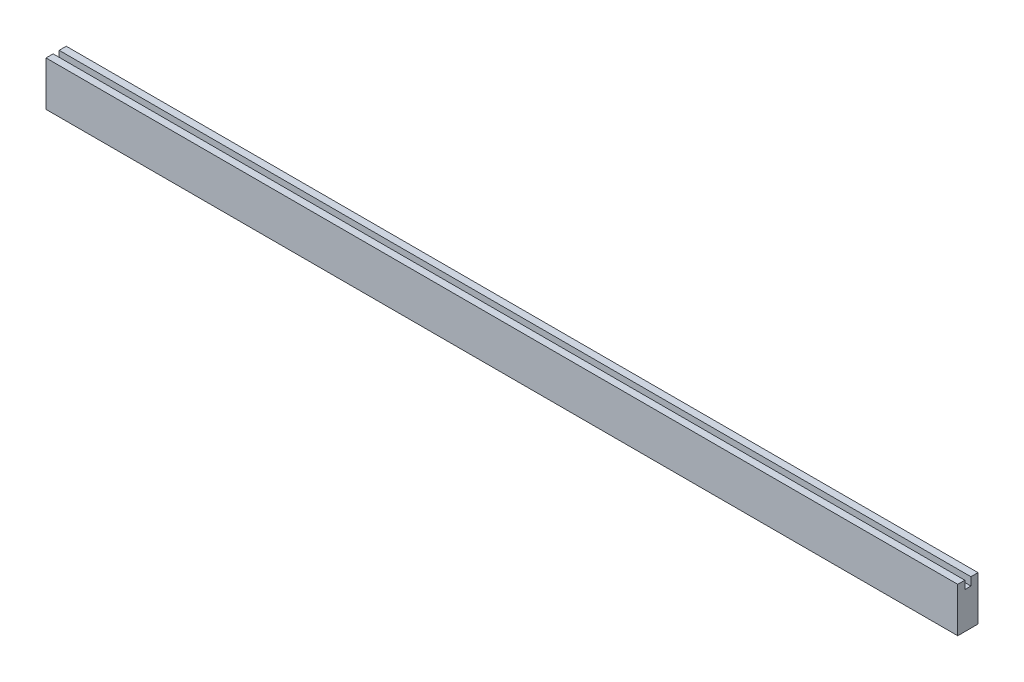
from build123d import *

# Parameters (mm, degrees)
SZKIC1_W                       = 450
SZKIC1_H                       = 10
DODANIE_WYCI_GNI_CIE1_DEPTH    = 22
SZKIC2_W                       = 450
SZKIC2_H                       = 3
WYTNIJ_WYCI_GNI_CIE1_DEPTH     = 4
OTWORY_USTALAJ_CE_3_0MM1_D     = 3
OTWORY_USTALAJ_CE_3_0MM1_DEPTH = 10
OTWORY_USTALAJ_CE_3_0MM1_TIP   = 0.901290929


with BuildPart() as part:
    # Szkic1 → Dodanie-wyciągnięcie1 (new body)
    with BuildSketch(Plane(origin=(0, 0, 0), x_dir=(1, 0, 0), z_dir=(0, 1, 0))):
        with Locations((-22.623576347, 5)):
            Rectangle(SZKIC1_W, SZKIC1_H)
    extrude(amount=DODANIE_WYCI_GNI_CIE1_DEPTH)

    # Szkic2 → Wytnij-wyciągnięcie1 (cut)
    with BuildSketch(Plane(origin=(0, 22, 0), x_dir=(1, 0, 0), z_dir=(0, 1, 0))):
        with Locations((-22.623576347, 5)):
            Rectangle(SZKIC2_W, SZKIC2_H)
    extrude(amount=-WYTNIJ_WYCI_GNI_CIE1_DEPTH, mode=Mode.SUBTRACT)

    # Otwory ustalające Ø3.0mm1
    with Locations(Plane(origin=(0, 0, 0), x_dir=(-1, 0, 0), z_dir=(0, -1, 0))):
        with Locations((-77.376423653, 5), (122.623576347, 5)):
            Hole(OTWORY_USTALAJ_CE_3_0MM1_D / 2, depth=OTWORY_USTALAJ_CE_3_0MM1_DEPTH)
            with Locations((0, 0, -(OTWORY_USTALAJ_CE_3_0MM1_DEPTH + OTWORY_USTALAJ_CE_3_0MM1_TIP / 2))):  # 118° drill point
                Cone(0, OTWORY_USTALAJ_CE_3_0MM1_D / 2, OTWORY_USTALAJ_CE_3_0MM1_TIP, mode=Mode.SUBTRACT)


solid = part.part
